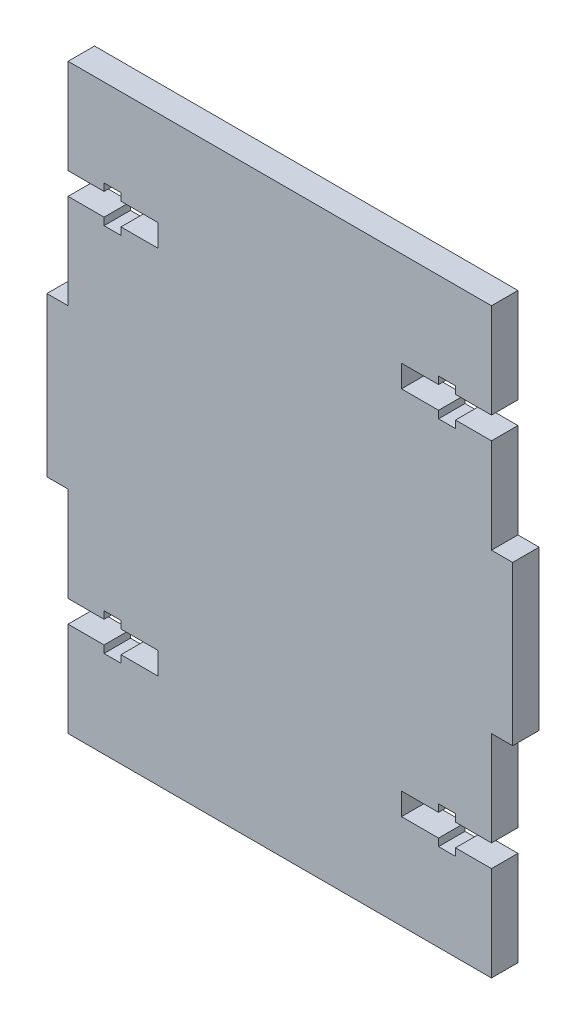
from build123d import *

# Parameters (mm, degrees)
ESQUISSE1_W             = 80
ESQUISSE1_H             = 110
BOSS_EXTRU_1_DEPTH      = 5
ENL_V_MAT_EXTRU_2_DEPTH = 137.106575888
ESQUISSE4_W             = 88
ESQUISSE4_H             = 30
BOSS_EXTRU_2_DEPTH      = 5


with BuildPart() as part:
    # Esquisse1 → Boss.-Extru.1 (new body)
    with BuildSketch(Plane.XY):
        with Locations((-40, 55)):
            Rectangle(ESQUISSE1_W, ESQUISSE1_H)
    extrude(amount=BOSS_EXTRU_1_DEPTH)

    # Esquisse3 → Enlèv. mat.-Extru.2 (cut, through all)
    with BuildSketch(Plane.XY.offset(5)):
        Polygon((-17, 87.9), (-10, 87.9), (-10, 86.5), (-6.8, 86.5), (-6.8, 87.9), (0, 87.9), (0, 92.1), (-6.8, 92.1), (-6.8, 93.5), (-10, 93.5), (-10, 92.1), (-17, 92.1), align=None)
        Polygon((-80, 92.1), (-80, 87.9), (-73.2, 87.9), (-73.2, 86.5), (-70, 86.5), (-70, 87.9), (-63, 87.9), (-63, 92.1), (-70, 92.1), (-70, 93.5), (-73.2, 93.5), (-73.2, 92.1), align=None)
        Polygon((-73.2, 22.1), (-80, 22.1), (-80, 17.9), (-73.2, 17.9), (-73.2, 16.5), (-70, 16.5), (-70, 17.9), (-63, 17.9), (-63, 22.1), (-70, 22.1), (-70, 23.5), (-73.2, 23.5), align=None)
        Polygon((0, 17.9), (0, 22.1), (-6.8, 22.1), (-6.8, 23.5), (-10, 23.5), (-10, 22.1), (-17, 22.1), (-17, 17.9), (-10, 17.9), (-10, 16.5), (-6.8, 16.5), (-6.8, 17.9), align=None)
    extrude(amount=-ENL_V_MAT_EXTRU_2_DEPTH, mode=Mode.SUBTRACT)

    # Esquisse4 → Boss.-Extru.2 (add)
    with BuildSketch(Plane(origin=(0, 0, 0), x_dir=(-1, 0, 0), z_dir=(0, 0, -1))):
        with Locations((40, 55)):
            Rectangle(ESQUISSE4_W, ESQUISSE4_H)
    extrude(amount=-BOSS_EXTRU_2_DEPTH)


solid = part.part
